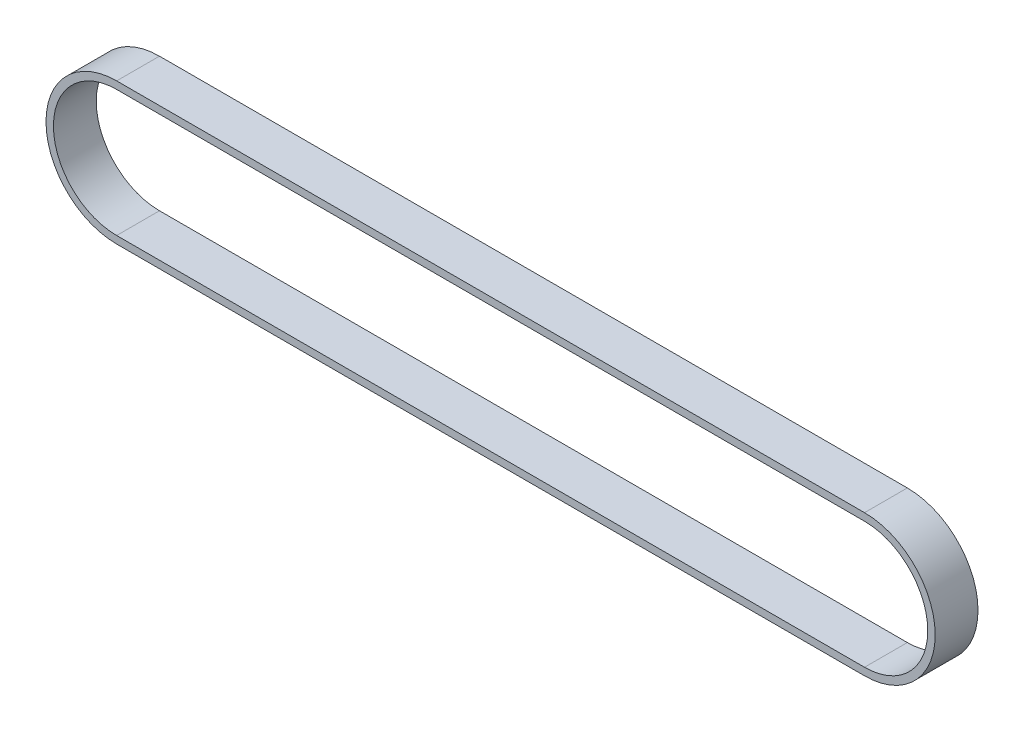
from build123d import *

# Parameters (mm, degrees)
BOSS_EXTRUDE1_DEPTH = 6.4
CUT_EXTRUDE1_DEPTH  = 123.951626667


with BuildPart() as part:
    # Sketch1 → Boss-Extrude1 (new body)
    with BuildSketch(Plane.XY):
        with BuildLine():
            Line((0, 10.56), (111.77, 10.56))
            ThreePointArc((111.77, 10.56), (122.33, 0), (111.77, -10.56))
            Line((111.77, -10.56), (0, -10.56))
            ThreePointArc((0, -10.56), (-10.56, 0), (0, 10.56))
        make_face()
    extrude(amount=BOSS_EXTRUDE1_DEPTH)

    # Sketch2 → Cut-Extrude1 (cut, through all)
    with BuildSketch(Plane.XY.offset(6.4)):
        with BuildLine():
            Line((0, 9.45), (111.77, 9.45))
            ThreePointArc((111.77, 9.45), (121.22, 0), (111.77, -9.45))
            Line((111.77, -9.45), (0, -9.45))
            ThreePointArc((0, -9.45), (-9.45, 0), (0, 9.45))
        make_face()
    extrude(amount=-CUT_EXTRUDE1_DEPTH, mode=Mode.SUBTRACT)


solid = part.part
